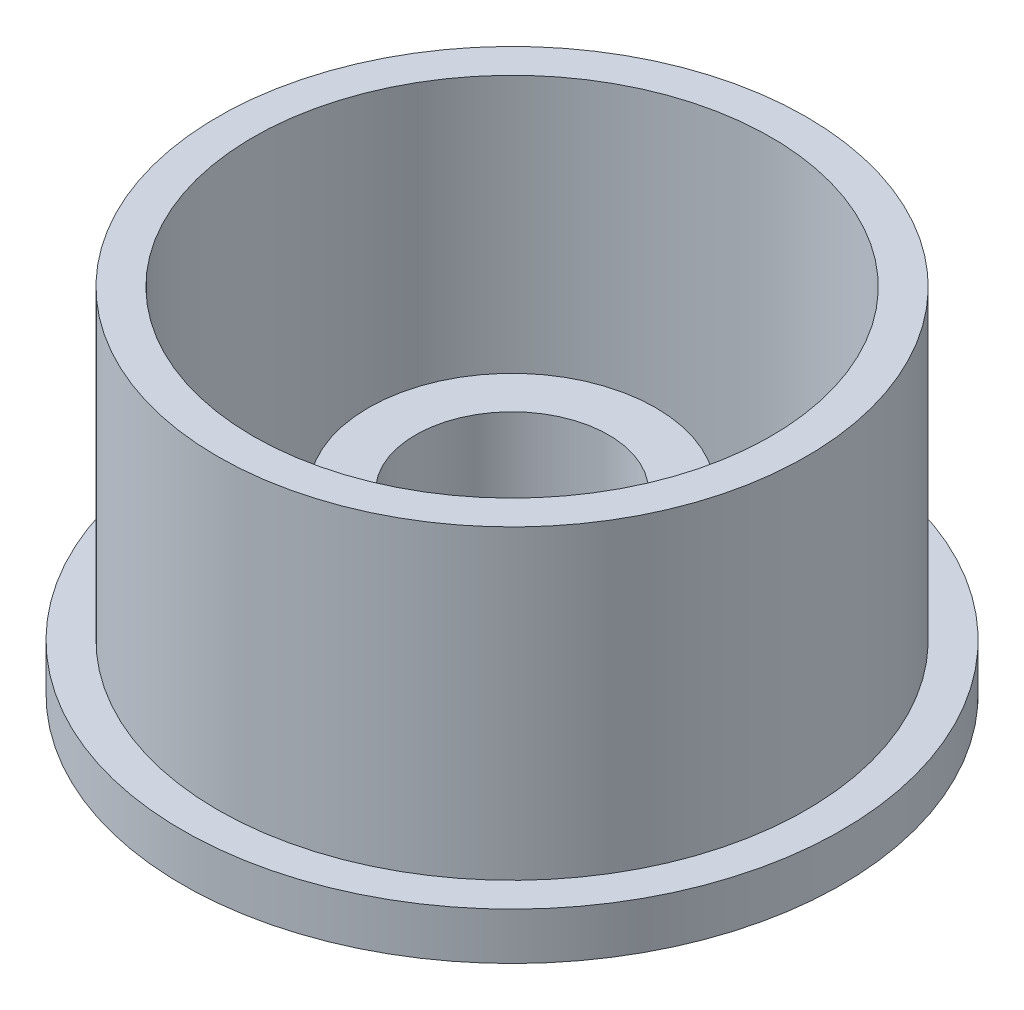
from build123d import *

# Parameters (mm, degrees)
SKETCH1_R           = 12.5
BOSS_EXTRUDE1_DEPTH = 15
SHELL1_T            = -1.5
SKETCH2_R           = 4.1
CUT_EXTRUDE1_DEPTH  = 20
BOSS_EXTRUDE2_START = 6
SKETCH3_R           = 6.1
SKETCH3_R_2         = 4.1
BOSS_EXTRUDE2_DEPTH = 6
SKETCH4_R           = 14
SKETCH4_R_2         = 11.5
BOSS_EXTRUDE3_DEPTH = 2


with BuildPart() as part:
    # Sketch1 → Boss-Extrude1 (new body)
    with BuildSketch(Plane(origin=(0, 0, 0), x_dir=(1, 0, 0), z_dir=(0, 1, 0))):
        with Locations(Location((0, 0, 0), (0, 0, 270))):
            Circle(SKETCH1_R)
    extrude(amount=BOSS_EXTRUDE1_DEPTH)

    # Shell1
    shell1_openings = [part.faces().sort_by_distance(p)[0] for p in [
        (0, 15, 0),
    ]]
    offset(amount=SHELL1_T, openings=shell1_openings, kind=Kind.INTERSECTION)

    # Sketch2 → Cut-Extrude1 (cut)
    with BuildSketch(Plane(origin=(0, 1.5, 0), x_dir=(1, 0, 0), z_dir=(0, 1, 0))):
        with Locations(Location((0, 0, 0), (0, 0, 270))):
            Circle(SKETCH2_R)
    extrude(amount=-CUT_EXTRUDE1_DEPTH, mode=Mode.SUBTRACT)

    # Sketch3 → Boss-Extrude2 (add)
    with BuildSketch(Plane(origin=(0, 1.5, 0), x_dir=(1, 0, 0), z_dir=(0, 1, 0)).offset(BOSS_EXTRUDE2_START)):
        with Locations(Location((0, 0, 0), (0, 0, 90))):
            Circle(SKETCH3_R)
        with Locations(Location((0, 0, 0), (0, 0, 270))):
            Circle(SKETCH3_R_2, mode=Mode.SUBTRACT)
    extrude(amount=-BOSS_EXTRUDE2_DEPTH)


with BuildPart() as body_2:
    # Sketch4 → Boss-Extrude3 (new body)
    with BuildSketch(Plane.XZ):
        with Locations(Location((0, 0, 0), (0, 0, 270))):
            Circle(SKETCH4_R)
        with Locations(Location((0, 0, 0), (0, 0, 270))):
            Circle(SKETCH4_R_2, mode=Mode.SUBTRACT)
    extrude(amount=-BOSS_EXTRUDE3_DEPTH)


with BuildPart() as part_1:
    add(part.part)

    # Combine1: union body 2
    add(body_2.part)


solid = part_1.part
